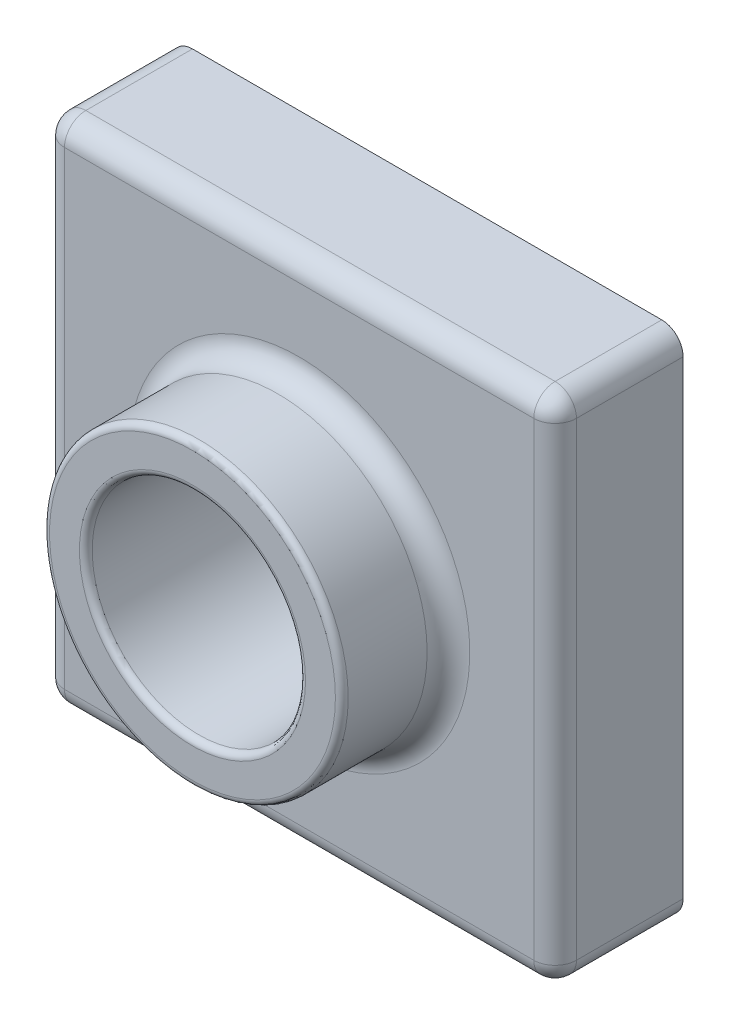
from build123d import *

# Parameters (mm, degrees)
SKETCH2_W           = 120
SKETCH2_H           = 120
BOSS_EXTRUDE1_DEPTH = 30
SKETCH4_R           = 35
BOSS_EXTRUDE2_DEPTH = 25
SKETCH6_R           = 25
CUT_EXTRUDE1_DEPTH  = 179.395627749
FILLET1_R           = 5
FILLET2_R           = 1.5


with BuildPart() as part:
    # Sketch2 → Boss-Extrude1 (new body)
    with BuildSketch(Plane.XY):
        with Locations((60, 60)):
            Rectangle(SKETCH2_W, SKETCH2_H)
    extrude(amount=BOSS_EXTRUDE1_DEPTH)

    # Sketch4 → Boss-Extrude2 (add)
    with BuildSketch(Plane.XY.offset(30)):
        with Locations(Location((60, 60, 0), (0, 0, 180))):
            Circle(SKETCH4_R)
    extrude(amount=BOSS_EXTRUDE2_DEPTH)

    # Sketch6 → Cut-Extrude1 (cut, through all)
    with BuildSketch(Plane.XY.offset(55)):
        with Locations((60, 60)):
            Circle(SKETCH6_R)
    extrude(amount=-CUT_EXTRUDE1_DEPTH, mode=Mode.SUBTRACT)

    # Fillet1
    fillet1_edges = [part.edges().sort_by_distance(p)[0] for p in [
        (120, 60, 30),
        (60, 120, 30),
        (95, 60, 30),
        (0, 60, 30),
        (60, 0, 30),
        (0, 120, 15),
        (120, 120, 15),
        (120, 0, 15),
        (0, 0, 15),
    ]]
    fillet(fillet1_edges, radius=FILLET1_R)

    # Fillet2
    fillet2_edges = [part.edges().sort_by_distance(p)[0] for p in [
        (95, 60, 55),
        (35, 60, 55),
    ]]
    fillet(fillet2_edges, radius=FILLET2_R)


solid = part.part
